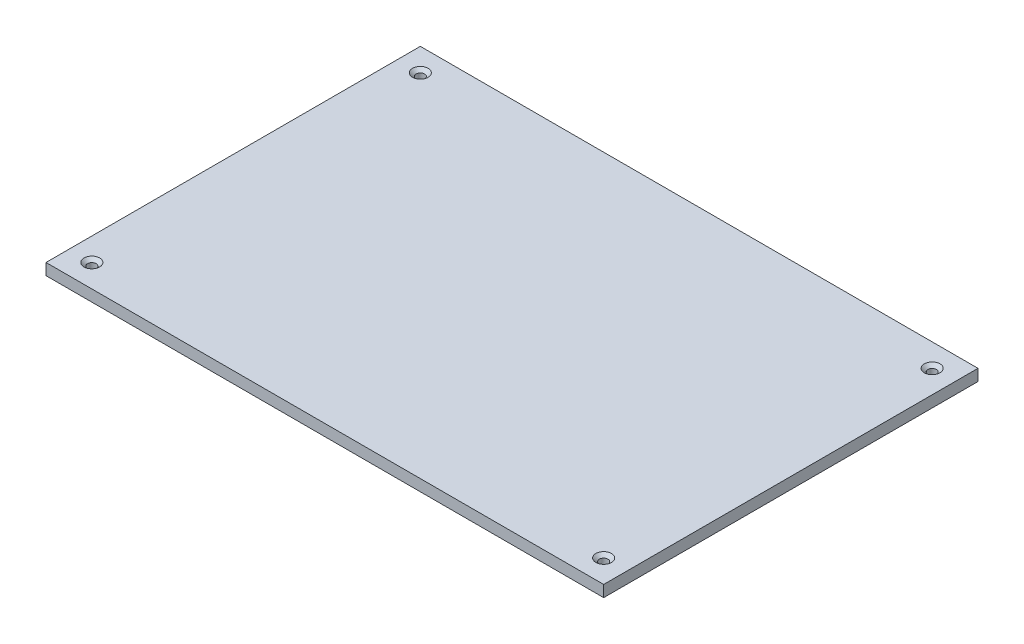
from build123d import *

# Parameters (mm, degrees)
SKETCH1_W           = 463.55
SKETCH1_H           = 311.15
BOSS_EXTRUDE1_DEPTH = 9.525
SKETCH2_R           = 3.571875
CUT_EXTRUDE1_DEPTH  = 9.525
CHAMFER1_SIZE       = 2.921
CHAMFER1_SIZE2      = 2.630080213


with BuildPart() as part:
    # Sketch1 → Boss-Extrude1 (new body)
    with BuildSketch(Plane(origin=(0, 0, 0), x_dir=(1, 0, 0), z_dir=(0, 1, 0))):
        with Locations((231.775, -155.575)):
            Rectangle(SKETCH1_W, SKETCH1_H)
    extrude(amount=BOSS_EXTRUDE1_DEPTH)

    # Sketch2 → Cut-Extrude1 (cut)
    with BuildSketch(Plane(origin=(0, 9.525, 0), x_dir=(1, 0, 0), z_dir=(0, 1, 0))):
        with Locations(Location((444.5, -19.05, 0), (0, 0, 270))):
            Circle(SKETCH2_R)
        with Locations(Location((19.05, -19.05, 0), (0, 0, 270))):
            Circle(SKETCH2_R)
        with Locations(Location((444.5, -292.1, 0), (0, 0, 270))):
            Circle(SKETCH2_R)
        with Locations(Location((19.05, -292.1, 0), (0, 0, 270))):
            Circle(SKETCH2_R)
    extrude(amount=-CUT_EXTRUDE1_DEPTH, mode=Mode.SUBTRACT)

    # Chamfer1
    chamfer1_edges = [part.edges().sort_by_distance(p)[0] for p in [
        (444.5, 9.525, 15.478125),
        (19.05, 9.525, 15.478125),
        (444.5, 9.525, 288.528125),
        (19.05, 9.525, 288.528125),
    ]]
    chamfer1_side = [part.faces().sort_by_distance(p)[0] for p in [
        (231.775, 9.525, 155.575),
    ]]
    chamfer(chamfer1_edges, length=CHAMFER1_SIZE, length2=CHAMFER1_SIZE2, reference=chamfer1_side[0])


solid = part.part
